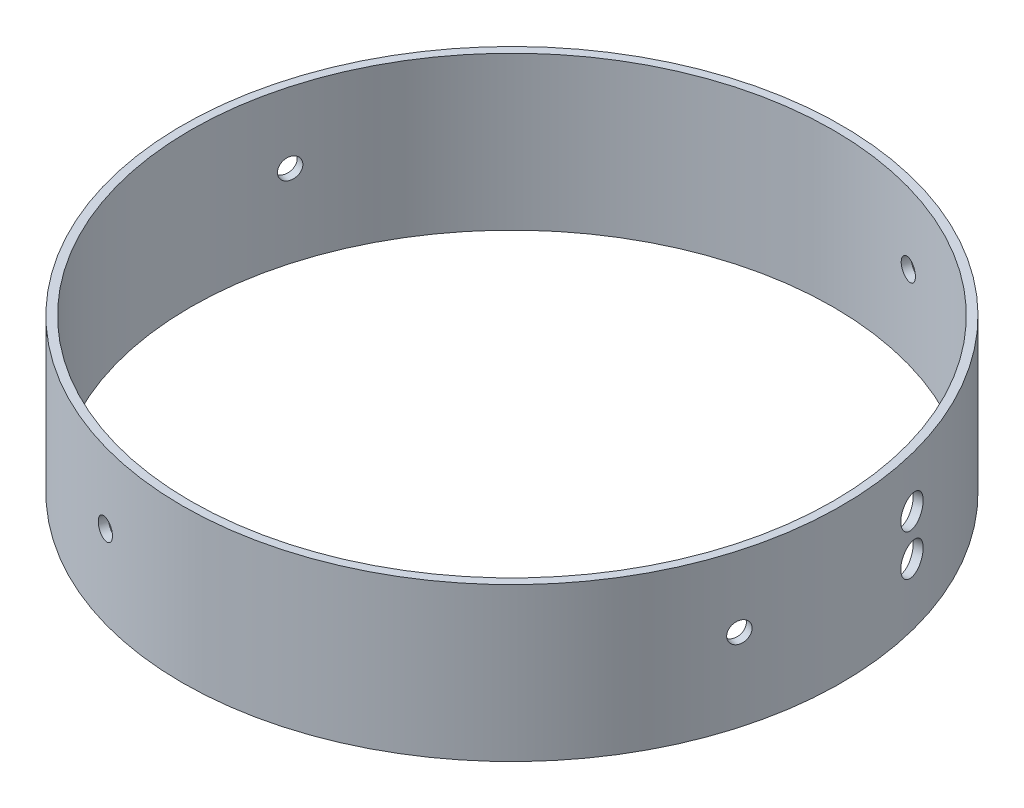
from build123d import *

# Parameters (mm, degrees)
SKETCH1_R           = 50.8
SKETCH1_R_2         = 49.53
BOSS_EXTRUDE1_DEPTH = 23.622
SKETCH2_R           = 2.38125
CUT_EXTRUDE1_DEPTH  = 25.4
SKETCH3_R           = 1.5875
CUT_EXTRUDE2_DEPTH  = 37.338
CIRPATTERN1_COUNT   = 4


with BuildPart() as part:
    # Sketch1 → Boss-Extrude1 (new body)
    with BuildSketch(Plane(origin=(0, 0, 0), x_dir=(1, 0, 0), z_dir=(0, 1, 0))):
        with Locations(Location((0, 0, 0), (0, 0, 270))):
            Circle(SKETCH1_R)
        with Locations(Location((0, 0, 0), (0, 0, 270))):
            Circle(SKETCH1_R_2, mode=Mode.SUBTRACT)
    extrude(amount=BOSS_EXTRUDE1_DEPTH)

    # Sketch2 → Cut-Extrude1 (cut)
    with BuildSketch(Plane(origin=(80.709285485, 206.333156205, 111.645979585), x_dir=(0, -1, 0), z_dir=(0.9693386284605577, 0, -0.2457287597620699))):
        with Locations(Location((196.808156205, 128.055353348, 0), (0, 0, 90))):
            Circle(SKETCH2_R)
        with Locations(Location((190.458156205, 128.055353348, 0), (0, 0, 90))):
            Circle(SKETCH2_R)
    extrude(amount=-CUT_EXTRUDE1_DEPTH, mode=Mode.SUBTRACT)

    # Sketch3 → Cut-Extrude2 (cut)
    with BuildSketch(Plane(origin=(-3.10026152, 207.778194099, 134.798971935), x_dir=(0, 1, 0), z_dir=(-0.962336256997443, 0, -0.27186196583588446))):
        with Locations(Location((-195.078194099, 130.56478129, 0), (0, 0, 270))):
            Circle(SKETCH3_R)
    cut_extrude2 = extrude(amount=-CUT_EXTRUDE2_DEPTH, mode=Mode.SUBTRACT)

    # CirPattern1: Cut-Extrude2 ×4 about axis
    cirpattern1_axis = Axis((0, 0, 0), (0, -1, 0))
    for i in range(1, CIRPATTERN1_COUNT):
        add(cut_extrude2.rotate(cirpattern1_axis, i * 360 / CIRPATTERN1_COUNT), mode=Mode.SUBTRACT)


solid = part.part
